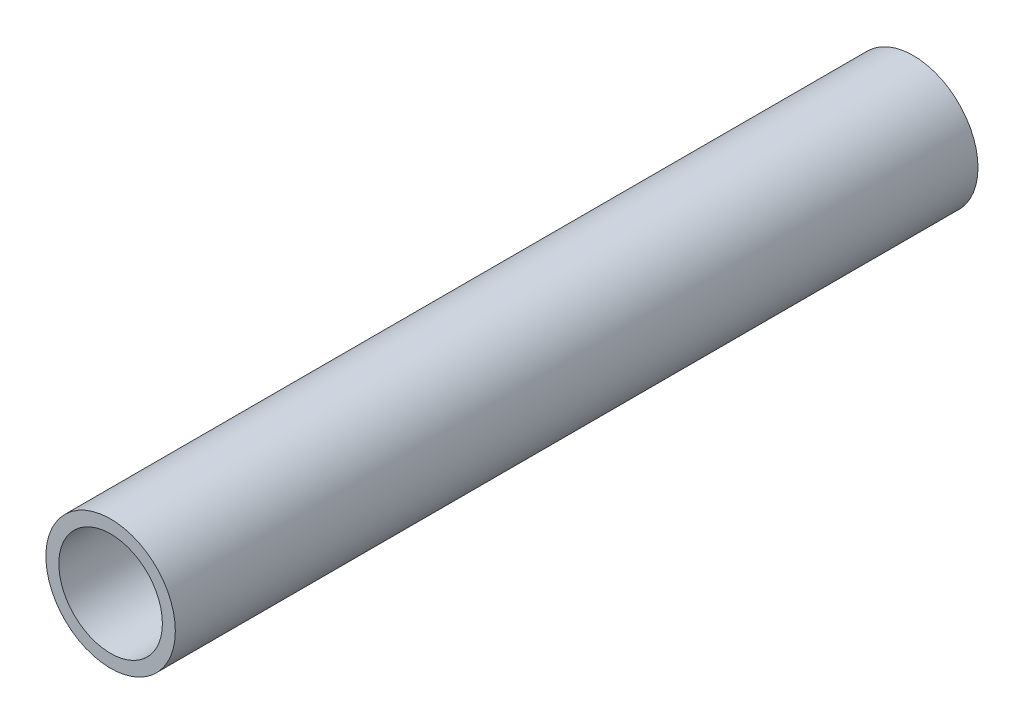
from build123d import *

# Parameters (mm, degrees)
SKETCH1_R           = 15.875
SKETCH1_R_2         = 12.7
BOSS_EXTRUDE1_DEPTH = 196.85


with BuildPart() as part:
    # Sketch1 → Boss-Extrude1 (new body)
    with BuildSketch(Plane.XY):
        Circle(SKETCH1_R)
        Circle(SKETCH1_R_2, mode=Mode.SUBTRACT)
    extrude(amount=BOSS_EXTRUDE1_DEPTH)


solid = part.part
